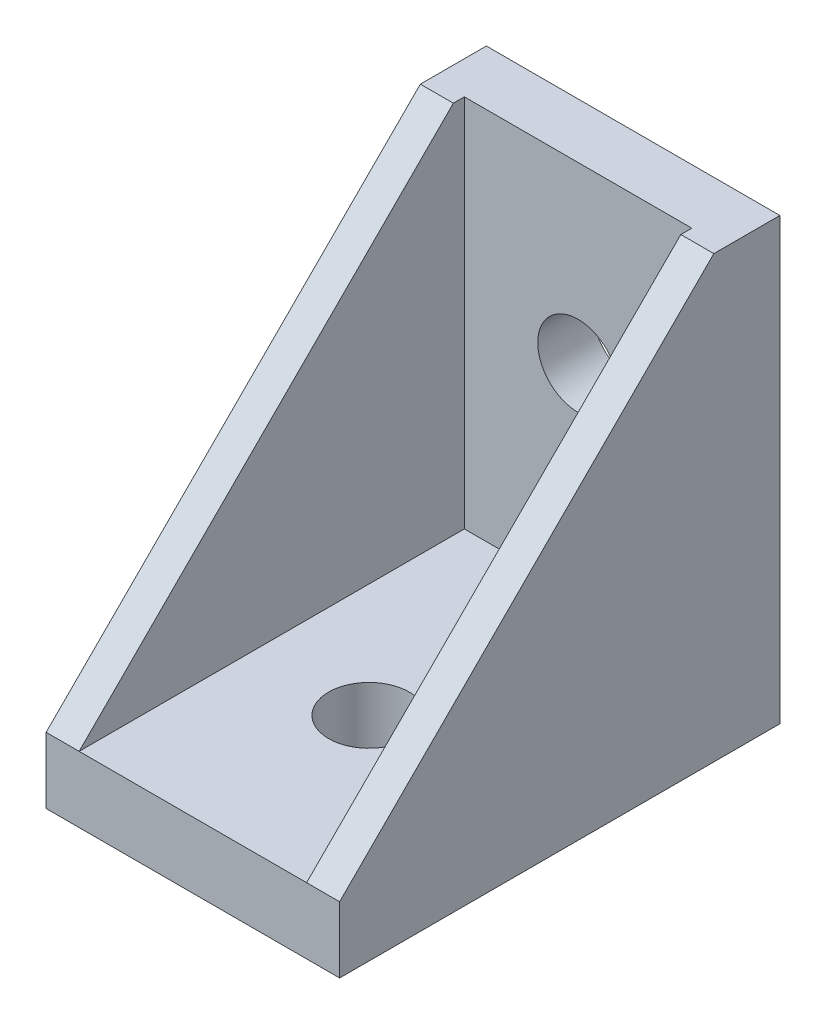
from build123d import *

# Parameters (mm, degrees)
BOSS_EXTRUDE1_DEPTH = 10
CUT_EXTRUDE1_DEPTH  = 7.75
SKETCH3_R           = 2.75
CUT_EXTRUDE2_DEPTH  = 15.5
SKETCH4_R           = 2.75
CUT_EXTRUDE3_DEPTH  = 15.5


with BuildPart() as part:
    # Sketch1 → Boss-Extrude1 (new, symmetric)
    with BuildSketch(Plane(origin=(0, 0, 0), x_dir=(0, 0, -1), z_dir=(1, 0, 0))):
        Polygon((-15, 0), (15, 0), (15, 30), (10.5, 30), (-15, 4.5), align=None)
    extrude(amount=BOSS_EXTRUDE1_DEPTH, both=True)

    # Sketch2 → Cut-Extrude1 (cut, symmetric)
    with BuildSketch(Plane(origin=(0, 0, 0), x_dir=(0, 0, -1), z_dir=(1, 0, 0))):
        Polygon((-11.25, 4.5), (11.25, 4.5), (11.25, 26.129344049), (11.25, 30), (10.5, 30), (-15, 4.5), align=None)
    extrude(amount=CUT_EXTRUDE1_DEPTH, both=True, mode=Mode.SUBTRACT)

    # Sketch3 → Cut-Extrude2 (cut)
    with BuildSketch(Plane.XY.offset(-11.25)):
        with Locations((0, 18)):
            Circle(SKETCH3_R)
    extrude(amount=-CUT_EXTRUDE2_DEPTH, mode=Mode.SUBTRACT)

    # Sketch4 → Cut-Extrude3 (cut)
    with BuildSketch(Plane(origin=(0, 4.5, 0), x_dir=(1, 0, 0), z_dir=(0, 1, 0))):
        with Locations(Location((0, -3, 0), (0, 0, 270))):
            Circle(SKETCH4_R)
    extrude(amount=-CUT_EXTRUDE3_DEPTH, mode=Mode.SUBTRACT)


solid = part.part
